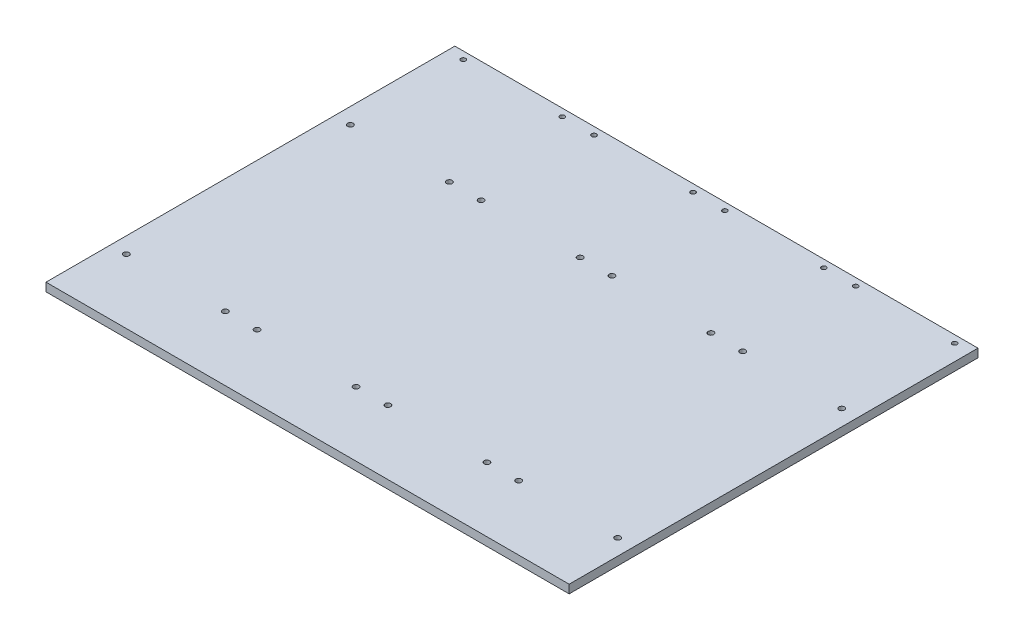
from build123d import *

# Parameters (mm, degrees)
SKETCH1_W           = 46.7
SKETCH1_H           = 145.995384974
SKETCH1_R           = 1
SKETCH1_R_2         = 0.85
BOSS_EXTRUDE1_DEPTH = 3


with BuildPart() as part:
    # Sketch1 → Boss-Extrude1 (new body)
    # profile 1 of 4: a face of its own
    with BuildSketch(Plane(origin=(0, 0, 0), x_dir=(1, 0, 0), z_dir=(0, 1, 0))):
        Rectangle(SKETCH1_W, SKETCH1_H)
        with Locations(Location((-17.675, -49.997692487, 0), (0, 0, 270))):
            Circle(SKETCH1_R, mode=Mode.SUBTRACT)
        with Locations(Location((17.675, -49.997692487, 0), (0, 0, 270))):
            Circle(SKETCH1_R, mode=Mode.SUBTRACT)
        with Locations(Location((-17.675, 30.002307513, 0), (0, 0, 270))):
            Circle(SKETCH1_R, mode=Mode.SUBTRACT)
        with Locations(Location((17.675, 30.002307513, 0), (0, 0, 270))):
            Circle(SKETCH1_R, mode=Mode.SUBTRACT)
        with Locations(Location((-17.675, 70.322692487, 0), (0, 0, 270))):
            Circle(SKETCH1_R_2, mode=Mode.SUBTRACT)
        with Locations(Location((17.675, 70.322692487, 0), (0, 0, 270))):
            Circle(SKETCH1_R_2, mode=Mode.SUBTRACT)
    # profile 2 of 4: a face of its own
    with BuildSketch(Plane(origin=(0, 0, 0), x_dir=(1, 0, 0), z_dir=(0, 1, 0))):
        with Locations((46.7, 0)):
            Rectangle(SKETCH1_W, SKETCH1_H)
        with Locations(Location((29.025, -49.997692487, 0), (0, 0, 270))):
            Circle(SKETCH1_R, mode=Mode.SUBTRACT)
        with Locations(Location((64.375, -49.997692487, 0), (0, 0, 270))):
            Circle(SKETCH1_R, mode=Mode.SUBTRACT)
        with Locations(Location((29.025, 30.002307513, 0), (0, 0, 270))):
            Circle(SKETCH1_R, mode=Mode.SUBTRACT)
        with Locations(Location((64.375, 30.002307513, 0), (0, 0, 270))):
            Circle(SKETCH1_R, mode=Mode.SUBTRACT)
        with Locations(Location((29.025, 70.322692487, 0), (0, 0, 270))):
            Circle(SKETCH1_R_2, mode=Mode.SUBTRACT)
        with Locations(Location((64.375, 70.322692487, 0), (0, 0, 270))):
            Circle(SKETCH1_R_2, mode=Mode.SUBTRACT)
    # profile 3 of 4: a face of its own
    with BuildSketch(Plane(origin=(0, 0, 0), x_dir=(1, 0, 0), z_dir=(0, 1, 0))):
        with Locations((93.4, 0)):
            Rectangle(SKETCH1_W, SKETCH1_H)
        with Locations(Location((75.725, -49.997692487, 0), (0, 0, 270))):
            Circle(SKETCH1_R, mode=Mode.SUBTRACT)
        with Locations(Location((111.075, -49.997692487, 0), (0, 0, 270))):
            Circle(SKETCH1_R, mode=Mode.SUBTRACT)
        with Locations(Location((75.725, 30.002307513, 0), (0, 0, 270))):
            Circle(SKETCH1_R, mode=Mode.SUBTRACT)
        with Locations(Location((111.075, 30.002307513, 0), (0, 0, 270))):
            Circle(SKETCH1_R, mode=Mode.SUBTRACT)
        with Locations(Location((75.725, 70.322692487, 0), (0, 0, 270))):
            Circle(SKETCH1_R_2, mode=Mode.SUBTRACT)
        with Locations(Location((111.075, 70.322692487, 0), (0, 0, 270))):
            Circle(SKETCH1_R_2, mode=Mode.SUBTRACT)
    # profile 4 of 4: a face of its own
    with BuildSketch(Plane(origin=(0, 0, 0), x_dir=(1, 0, 0), z_dir=(0, 1, 0))):
        with Locations((140.1, 0)):
            Rectangle(SKETCH1_W, SKETCH1_H)
        with Locations(Location((122.425, -49.997692487, 0), (0, 0, 270))):
            Circle(SKETCH1_R, mode=Mode.SUBTRACT)
        with Locations(Location((157.775, -49.997692487, 0), (0, 0, 270))):
            Circle(SKETCH1_R, mode=Mode.SUBTRACT)
        with Locations(Location((122.425, 30.002307513, 0), (0, 0, 270))):
            Circle(SKETCH1_R, mode=Mode.SUBTRACT)
        with Locations(Location((157.775, 30.002307513, 0), (0, 0, 270))):
            Circle(SKETCH1_R, mode=Mode.SUBTRACT)
        with Locations(Location((122.425, 70.322692487, 0), (0, 0, 270))):
            Circle(SKETCH1_R_2, mode=Mode.SUBTRACT)
        with Locations(Location((157.775, 70.322692487, 0), (0, 0, 270))):
            Circle(SKETCH1_R_2, mode=Mode.SUBTRACT)
    extrude(amount=BOSS_EXTRUDE1_DEPTH)


solid = part.part
